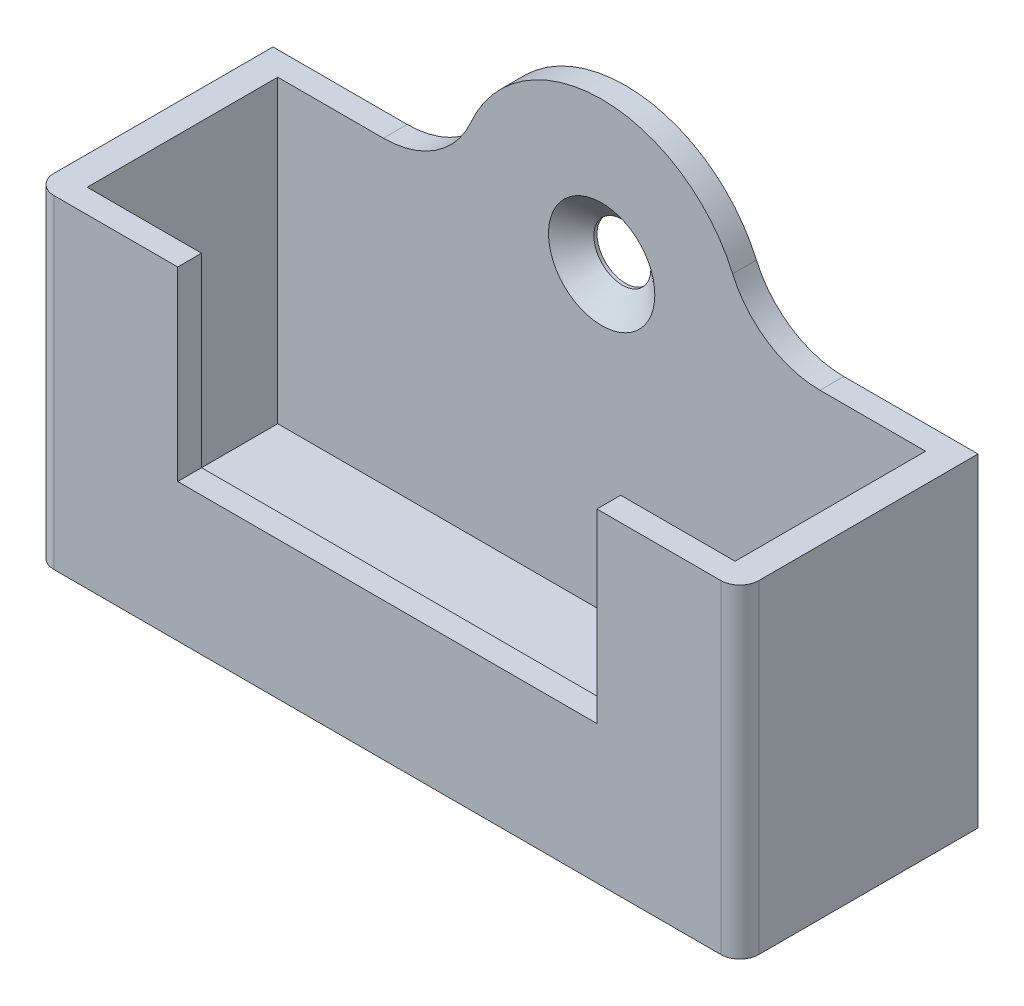
from build123d import *

# Parameters (mm, degrees)
SKETCH1_W           = 46.99
SKETCH1_H           = 15.875
BOSS_EXTRUDE1_DEPTH = 21.59
SKETCH2_W           = 43.18
SKETCH2_H           = 12.7
SKETCH2_W_2         = 27.94
SKETCH2_H_2         = 1.5875
CUT_EXTRUDE1_DEPTH  = 20.0025
SKETCH3_R           = 9.525
BOSS_EXTRUDE2_DEPTH = 1.5875
FILLET1_R           = 6.35
FILLET2_R           = 1.27
SKETCH9_W           = 27.94
SKETCH9_H           = 1.5875
BOSS_EXTRUDE3_DEPTH = 7.62


with BuildPart() as part:
    # Sketch1 → Boss-Extrude1 (new body)
    with BuildSketch(Plane(origin=(0, 0, 0), x_dir=(1, 0, 0), z_dir=(0, 1, 0))):
        Rectangle(SKETCH1_W, SKETCH1_H)
    extrude(amount=BOSS_EXTRUDE1_DEPTH)

    # Sketch2 → Cut-Extrude1 (cut)
    with BuildSketch(Plane(origin=(0, 21.59, 0), x_dir=(1, 0, 0), z_dir=(0, 1, 0))):
        Rectangle(SKETCH2_W, SKETCH2_H)
        with Locations((0, -7.14375)):
            Rectangle(SKETCH2_W_2, SKETCH2_H_2)
    extrude(amount=-CUT_EXTRUDE1_DEPTH, mode=Mode.SUBTRACT)

    # Sketch3 → Boss-Extrude2 (add)
    with BuildSketch(Plane.XY.offset(-6.35)):
        with Locations((0, 21.59)):
            Circle(SKETCH3_R)
    extrude(amount=-BOSS_EXTRUDE2_DEPTH)

    # Sketch7 → CSK for #6 Flat Head Machine Screw (100)1 (revolve, cut)
    with BuildSketch(Plane(origin=(0, 21.59, -6.35), x_dir=(0, -1, 0), z_dir=(1, 0, 0))):
        Polygon((0, 0), (0, 1.5875), (1.89865, 1.5875), (1.89865, 1.380025208), (3.5433, 0), align=None)
    revolve(axis=Axis((0, 21.59, 0), (0, 0, -1)), mode=Mode.SUBTRACT)

    # Fillet1
    fillet1_edges = [part.edges().sort_by_distance(p)[0] for p in [
        (9.525, 21.59, -7.14375),
        (-9.525, 21.59, -7.14375),
    ]]
    fillet(fillet1_edges, radius=FILLET1_R)

    # Fillet2
    fillet2_edges = [part.edges().sort_by_distance(p)[0] for p in [
        (23.495, 10.795, 7.9375),
        (-23.495, 10.795, 7.9375),
    ]]
    fillet(fillet2_edges, radius=FILLET2_R)

    # Sketch9 → Boss-Extrude3 (add)
    with BuildSketch(Plane(origin=(0, 1.5875, 0), x_dir=(1, 0, 0), z_dir=(0, 1, 0))):
        with Locations((0, -7.14375)):
            Rectangle(SKETCH9_W, SKETCH9_H)
    extrude(amount=BOSS_EXTRUDE3_DEPTH)


solid = part.part
